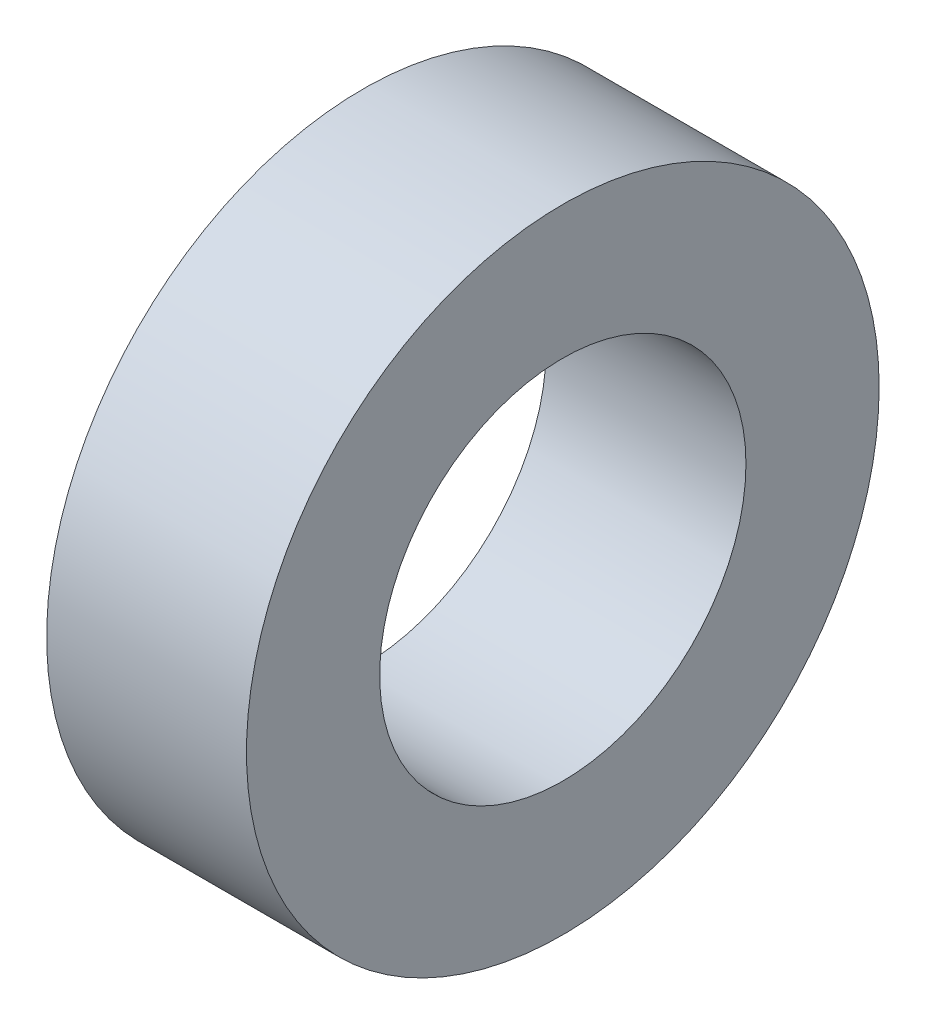
from build123d import *

# Parameters (mm, degrees)
CROQUIS1_R              = 4.75
CROQUIS1_R_2            = 2.75
SALIENTE_EXTRUIR1_DEPTH = 3


with BuildPart() as part:
    # Croquis1 → Saliente-Extruir1 (new body)
    with BuildSketch(Plane(origin=(0, 0, 0), x_dir=(0, 0, -1), z_dir=(1, 0, 0))):
        Circle(CROQUIS1_R)
        Circle(CROQUIS1_R_2, mode=Mode.SUBTRACT)
    extrude(amount=SALIENTE_EXTRUIR1_DEPTH)


solid = part.part
